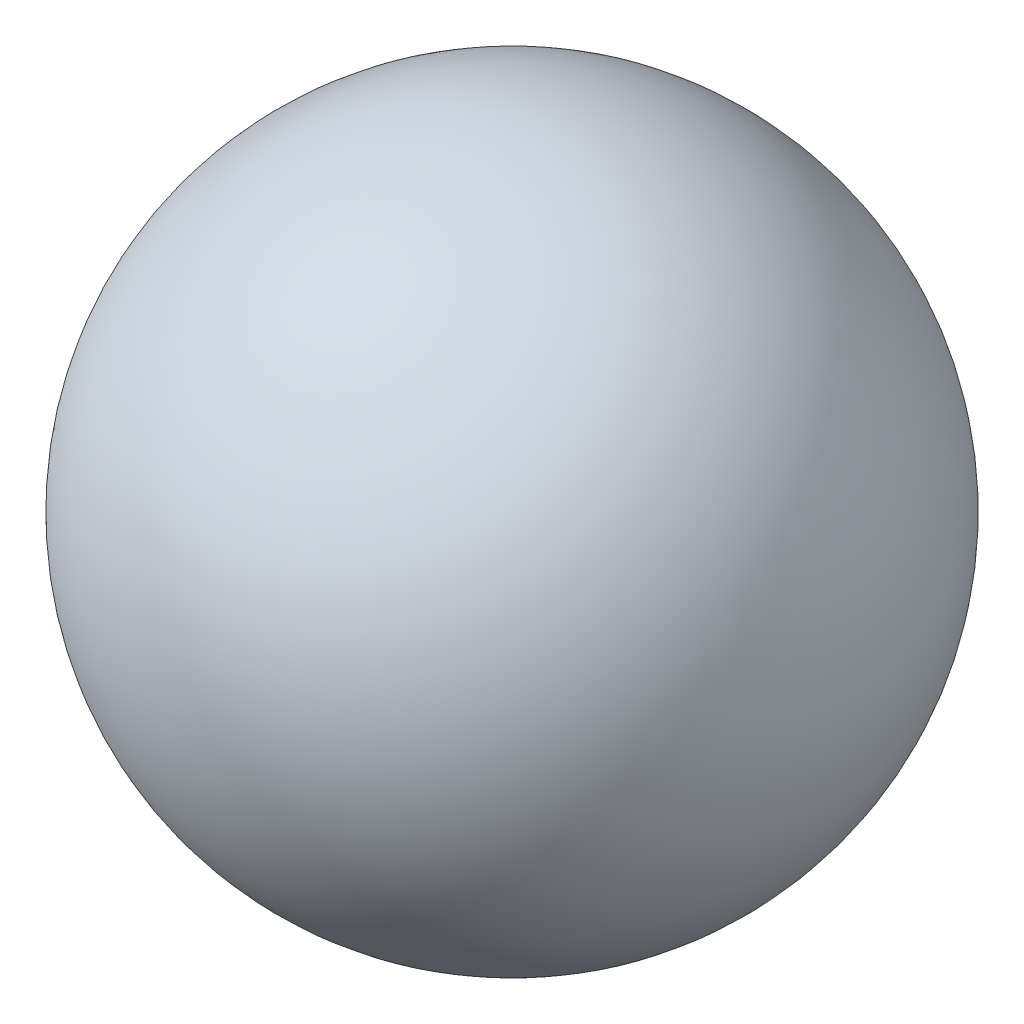
from build123d import *


with BuildPart() as part:
    # Sketch1 → Revolve1 (revolve)
    with BuildSketch(Plane.XY):
        with BuildLine():
            Line((0, 31.5), (0, -31.5))
            ThreePointArc((0, -31.5), (31.5, 0), (0, 31.5))
        make_face()
    revolve(axis=Axis((0, 31.5, 0), (0, -1, 0)))


solid = part.part
